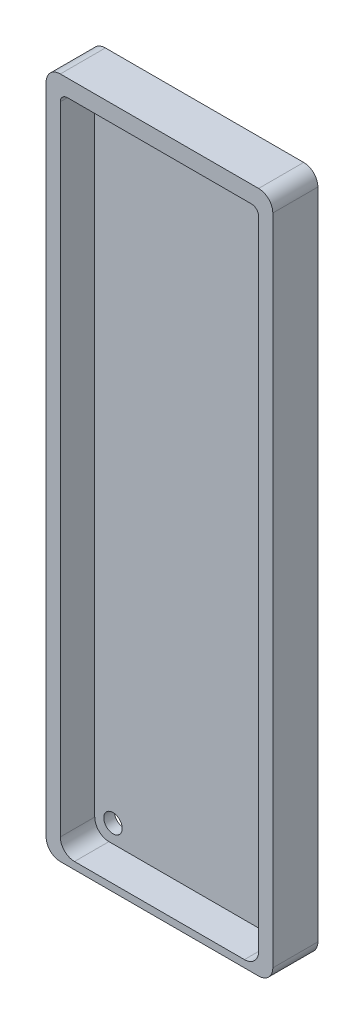
from build123d import *

# Parameters (mm, degrees)
BOSS_EXTRU_1_DEPTH      = 1.5
BOSS_EXTRU_2_DEPTH      = 6.35
ESQUISSE2_W             = 2.048679464
ESQUISSE2_H             = 2.722217918
ESQUISSE2_W_2           = 2.383965353
ESQUISSE2_H_2           = 1.994278708
BOSS_EXTRU_3_DEPTH      = 1.5
ESQUISSE3_R             = 1.3
ENL_V_MAT_EXTRU_1_DEPTH = 170.97185291


with BuildPart() as part:
    # Model → Boss.-Extru.1 (new body)
    with BuildSketch(Plane.XY):
        with BuildLine():
            Line((110.49, -34.813931), (110.49, -38.623931))
            Line((110.49, -38.623931), (110.49, -39.893931))
            Line((110.49, -39.893931), (110.49, -123.713931))
            add(Edge.make_bspline(
                [(109.746051, -125.509982), (110.222394, -125.03364), (110.49, -124.387581), (110.49, -123.713931)],
                knots=[0, 0, 0, 0, 1, 1, 1, 1], degree=3))
            add(Edge.make_bspline(
                [(107.95, -126.253931), (108.62365, -126.253931), (109.269709, -125.986325), (109.746051, -125.509982)],
                knots=[0, 0, 0, 0, 1, 1, 1, 1], degree=3))
            Line((107.95, -126.253931), (85.09, -126.253931))
            add(Edge.make_bspline(
                [(83.293949, -125.509982), (83.770291, -125.986325), (84.41635, -126.253931), (85.09, -126.253931)],
                knots=[0, 0, 0, 0, 1, 1, 1, 1], degree=3))
            add(Edge.make_bspline(
                [(82.55, -123.713931), (82.55, -124.387581), (82.817606, -125.03364), (83.293949, -125.509982)],
                knots=[0, 0, 0, 0, 1, 1, 1, 1], degree=3))
            Line((82.55, -123.713931), (82.55, -39.893931))
            Line((82.55, -39.893931), (82.55, -38.623931))
            Line((82.55, -38.623931), (82.55, -34.813931))
            add(Edge.make_bspline(
                [(82.921974, -33.915905), (82.683803, -34.154076), (82.55, -34.477106), (82.55, -34.813931)],
                knots=[0, 0, 0, 0, 1, 1, 1, 1], degree=3))
            add(Edge.make_bspline(
                [(83.82, -33.543931), (83.483175, -33.543931), (83.160146, -33.677734), (82.921974, -33.915905)],
                knots=[0, 0, 0, 0, 1, 1, 1, 1], degree=3))
            Line((83.82, -33.543931), (109.22, -33.543931))
            add(Edge.make_bspline(
                [(110.118026, -33.915905), (109.879854, -33.677734), (109.556825, -33.543931), (109.22, -33.543931)],
                knots=[0, 0, 0, 0, 1, 1, 1, 1], degree=3))
            add(Edge.make_bspline(
                [(110.49, -34.813931), (110.49, -34.477106), (110.356197, -34.154076), (110.118026, -33.915905)],
                knots=[0, 0, 0, 0, 1, 1, 1, 1], degree=3))
        make_face()
        with BuildLine():
            add(Edge.make_bspline(
                [(109.22, -36.083931), (109.22, -36.537658), (108.977939, -36.956919), (108.585, -37.183783)],
                knots=[0, 0, 0, 0, 1, 1, 1, 1], degree=3))
            add(Edge.make_bspline(
                [(108.585, -37.183783), (108.192061, -37.410647), (107.707939, -37.410647), (107.315, -37.183783)],
                knots=[0, 0, 0, 0, 1, 1, 1, 1], degree=3))
            add(Edge.make_bspline(
                [(107.315, -37.183783), (106.922061, -36.956919), (106.68, -36.537658), (106.68, -36.083931)],
                knots=[0, 0, 0, 0, 1, 1, 1, 1], degree=3))
            add(Edge.make_bspline(
                [(106.68, -36.083931), (106.68, -35.630204), (106.922061, -35.210942), (107.315, -34.984079)],
                knots=[0, 0, 0, 0, 1, 1, 1, 1], degree=3))
            add(Edge.make_bspline(
                [(107.315, -34.984079), (107.707939, -34.757215), (108.192061, -34.757215), (108.585, -34.984079)],
                knots=[0, 0, 0, 0, 1, 1, 1, 1], degree=3))
            add(Edge.make_bspline(
                [(108.585, -34.984079), (108.977939, -35.210942), (109.22, -35.630204), (109.22, -36.083931)],
                knots=[0, 0, 0, 0, 1, 1, 1, 1], degree=3))
        make_face(mode=Mode.SUBTRACT)
        with BuildLine():
            add(Edge.make_bspline(
                [(86.36, -36.083931), (86.36, -36.537658), (86.117939, -36.956919), (85.725, -37.183783)],
                knots=[0, 0, 0, 0, 1, 1, 1, 1], degree=3))
            add(Edge.make_bspline(
                [(85.725, -37.183783), (85.332061, -37.410647), (84.847939, -37.410647), (84.455, -37.183783)],
                knots=[0, 0, 0, 0, 1, 1, 1, 1], degree=3))
            add(Edge.make_bspline(
                [(84.455, -37.183783), (84.062061, -36.956919), (83.82, -36.537658), (83.82, -36.083931)],
                knots=[0, 0, 0, 0, 1, 1, 1, 1], degree=3))
            add(Edge.make_bspline(
                [(83.82, -36.083931), (83.82, -35.630204), (84.062061, -35.210942), (84.455, -34.984079)],
                knots=[0, 0, 0, 0, 1, 1, 1, 1], degree=3))
            add(Edge.make_bspline(
                [(84.455, -34.984079), (84.847939, -34.757215), (85.332061, -34.757215), (85.725, -34.984079)],
                knots=[0, 0, 0, 0, 1, 1, 1, 1], degree=3))
            add(Edge.make_bspline(
                [(85.725, -34.984079), (86.117939, -35.210942), (86.36, -35.630204), (86.36, -36.083931)],
                knots=[0, 0, 0, 0, 1, 1, 1, 1], degree=3))
        make_face(mode=Mode.SUBTRACT)
        with BuildLine():
            add(Edge.make_bspline(
                [(86.36, -123.713931), (86.36, -124.167658), (86.117939, -124.586919), (85.725, -124.813783)],
                knots=[0, 0, 0, 0, 1, 1, 1, 1], degree=3))
            add(Edge.make_bspline(
                [(85.725, -124.813783), (85.332061, -125.040647), (84.847939, -125.040647), (84.455, -124.813783)],
                knots=[0, 0, 0, 0, 1, 1, 1, 1], degree=3))
            add(Edge.make_bspline(
                [(84.455, -124.813783), (84.062061, -124.586919), (83.82, -124.167658), (83.82, -123.713931)],
                knots=[0, 0, 0, 0, 1, 1, 1, 1], degree=3))
            add(Edge.make_bspline(
                [(83.82, -123.713931), (83.82, -123.260204), (84.062061, -122.840942), (84.455, -122.614079)],
                knots=[0, 0, 0, 0, 1, 1, 1, 1], degree=3))
            add(Edge.make_bspline(
                [(84.455, -122.614079), (84.847939, -122.387215), (85.332061, -122.387215), (85.725, -122.614079)],
                knots=[0, 0, 0, 0, 1, 1, 1, 1], degree=3))
            add(Edge.make_bspline(
                [(85.725, -122.614079), (86.117939, -122.840942), (86.36, -123.260204), (86.36, -123.713931)],
                knots=[0, 0, 0, 0, 1, 1, 1, 1], degree=3))
        make_face(mode=Mode.SUBTRACT)
        with BuildLine():
            add(Edge.make_bspline(
                [(109.22, -123.713931), (109.22, -124.167658), (108.977939, -124.586919), (108.585, -124.813783)],
                knots=[0, 0, 0, 0, 1, 1, 1, 1], degree=3))
            add(Edge.make_bspline(
                [(108.585, -124.813783), (108.192061, -125.040647), (107.707939, -125.040647), (107.315, -124.813783)],
                knots=[0, 0, 0, 0, 1, 1, 1, 1], degree=3))
            add(Edge.make_bspline(
                [(107.315, -124.813783), (106.922061, -124.586919), (106.68, -124.167658), (106.68, -123.713931)],
                knots=[0, 0, 0, 0, 1, 1, 1, 1], degree=3))
            add(Edge.make_bspline(
                [(106.68, -123.713931), (106.68, -123.260204), (106.922061, -122.840942), (107.315, -122.614079)],
                knots=[0, 0, 0, 0, 1, 1, 1, 1], degree=3))
            add(Edge.make_bspline(
                [(107.315, -122.614079), (107.707939, -122.387215), (108.192061, -122.387215), (108.585, -122.614079)],
                knots=[0, 0, 0, 0, 1, 1, 1, 1], degree=3))
            add(Edge.make_bspline(
                [(108.585, -122.614079), (108.977939, -122.840942), (109.22, -123.260204), (109.22, -123.713931)],
                knots=[0, 0, 0, 0, 1, 1, 1, 1], degree=3))
        make_face(mode=Mode.SUBTRACT)
    extrude(amount=BOSS_EXTRU_1_DEPTH)

    # Esquisse1 → Boss.-Extru.2 (add)
    with BuildSketch(Plane(origin=(0, 0, 0), x_dir=(-1, 0, 0), z_dir=(0, 0, -1))):
        with BuildLine():
            Line((-110.49, -31.152890146), (-82.55, -31.152890146))
            ThreePointArc((-82.55, -31.152890146), (-81.135786438, -31.738676584), (-80.55, -33.152890146))
            Line((-80.55, -33.152890146), (-80.55, -125.263931))
            ThreePointArc((-80.55, -125.263931), (-81.135786438, -126.678144562), (-82.55, -127.263931))
            Line((-82.55, -127.263931), (-110.49, -127.263931))
            ThreePointArc((-110.49, -127.263931), (-111.904213562, -126.678144562), (-112.49, -125.263931))
            Line((-112.49, -125.263931), (-112.49, -33.152890146))
            ThreePointArc((-112.49, -33.152890146), (-111.904213562, -31.738676584), (-110.49, -31.152890146))
        make_face()
        with BuildLine():
            Line((-109.49, -33.543931), (-83.55, -33.543931))
            ThreePointArc((-83.55, -33.543931), (-82.842893219, -33.836824219), (-82.55, -34.543931))
            Line((-82.55, -34.543931), (-82.55, -124.253931))
            ThreePointArc((-82.55, -124.253931), (-83.135786438, -125.668144562), (-84.55, -126.253931))
            Line((-84.55, -126.253931), (-108.49, -126.253931))
            ThreePointArc((-108.49, -126.253931), (-109.904213562, -125.668144562), (-110.49, -124.253931))
            Line((-110.49, -124.253931), (-110.49, -34.543931))
            ThreePointArc((-110.49, -34.543931), (-110.197106781, -33.836824219), (-109.49, -33.543931))
        make_face(mode=Mode.SUBTRACT)
    extrude(amount=-BOSS_EXTRU_2_DEPTH)

    # Esquisse2 → Boss.-Extru.3 (add)
    with BuildSketch(Plane.XY.offset(1.5)):
        Polygon((82.862908546, -122.803540967), (81.718920114, -124.049976123), (82.862908546, -126.448936938), (85.492374492, -126.781888794), (85.441151129, -125.817182132), (83.793466299, -125.023220012), (83.059264769, -123.828008219), align=None)
        with Locations((82.84166356, -34.077464167)):
            Rectangle(ESQUISSE2_W, ESQUISSE2_H)
        with Locations((109.83167143, -33.789106507)):
            Rectangle(ESQUISSE2_W_2, ESQUISSE2_H_2)
        Polygon((111.079756548, -122.69864172), (110.01722417, -123.503842038), (109.201933768, -125.195788786), (107.319834078, -125.55652456), (107.178740755, -126.670800036), (110.27455623, -126.615412866), (111.506281277, -125.468783374), align=None)
    extrude(amount=-BOSS_EXTRU_3_DEPTH)

    # Esquisse3 → Enlèv. mat.-Extru.1 (cut, through all)
    with BuildSketch(Plane(origin=(0, 0, 0), x_dir=(-1, 0, 0), z_dir=(0, 0, -1))):
        with Locations((-107.952359108, -36.080520753)):
            Circle(ESQUISSE3_R)
        with Locations((-85.119999339, -36.08524195)):
            Circle(ESQUISSE3_R)
        with Locations((-107.979999813, -123.71323395)):
            Circle(ESQUISSE3_R)
        with Locations((-85.119999826, -123.713259066)):
            Circle(ESQUISSE3_R)
    extrude(amount=-ENL_V_MAT_EXTRU_1_DEPTH, mode=Mode.SUBTRACT)


solid = part.part
